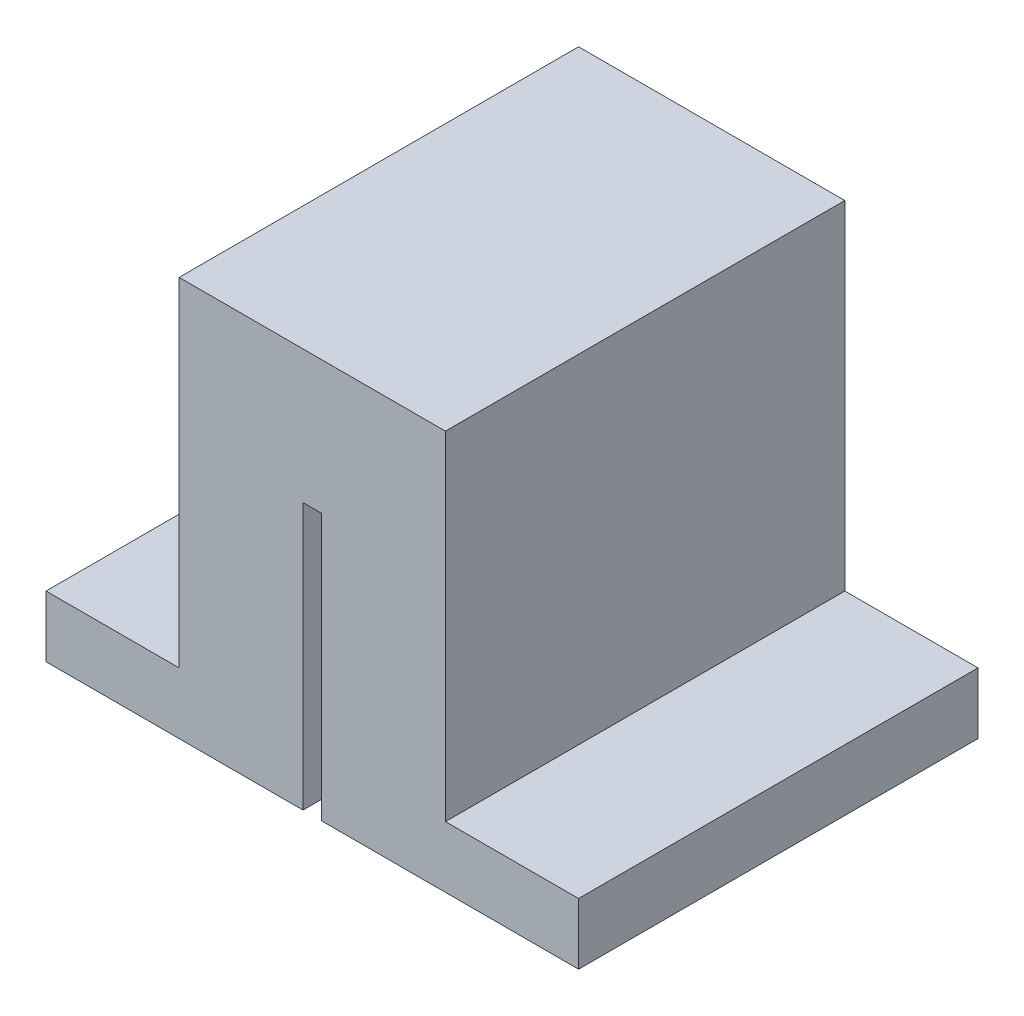
from build123d import *

# Parameters (mm, degrees)
SKETCH1_W               = 10
SKETCH1_H               = 15
BOSS_EXTRUDE1_DEPTH     = 15
CUT_EXTRUDE1_DEPTH      = 18.5
CUT_EXTRUDE1_DEPTH_BACK = 18.5
SKETCH2_W               = 0.7
SKETCH2_H               = 10
SKETCH3_W               = 5
SKETCH3_H               = 2.3
BOSS_EXTRUDE2_DEPTH     = 15


with BuildPart() as part:
    # Sketch1 → Boss-Extrude1 (new body)
    with BuildSketch(Plane.XY):
        Rectangle(SKETCH1_W, SKETCH1_H)
    extrude(amount=BOSS_EXTRUDE1_DEPTH)

    # Sketch2 → Cut-Extrude1 (cut, two sides: drawn at the far end of the back side and taken through both)
    with BuildSketch(Plane.XY.offset(15).offset(-CUT_EXTRUDE1_DEPTH_BACK)):
        with Locations((0, -2.5)):
            Rectangle(SKETCH2_W, SKETCH2_H)
    extrude(amount=CUT_EXTRUDE1_DEPTH + CUT_EXTRUDE1_DEPTH_BACK, mode=Mode.SUBTRACT)

    # Sketch3 → Boss-Extrude2 (add)
    with BuildSketch(Plane.XY.offset(15)):
        with Locations((-7.5, -6.35)):
            Rectangle(SKETCH3_W, SKETCH3_H)
        with Locations((7.5, -6.35)):
            Rectangle(SKETCH3_W, SKETCH3_H)
    extrude(amount=-BOSS_EXTRUDE2_DEPTH)


solid = part.part
